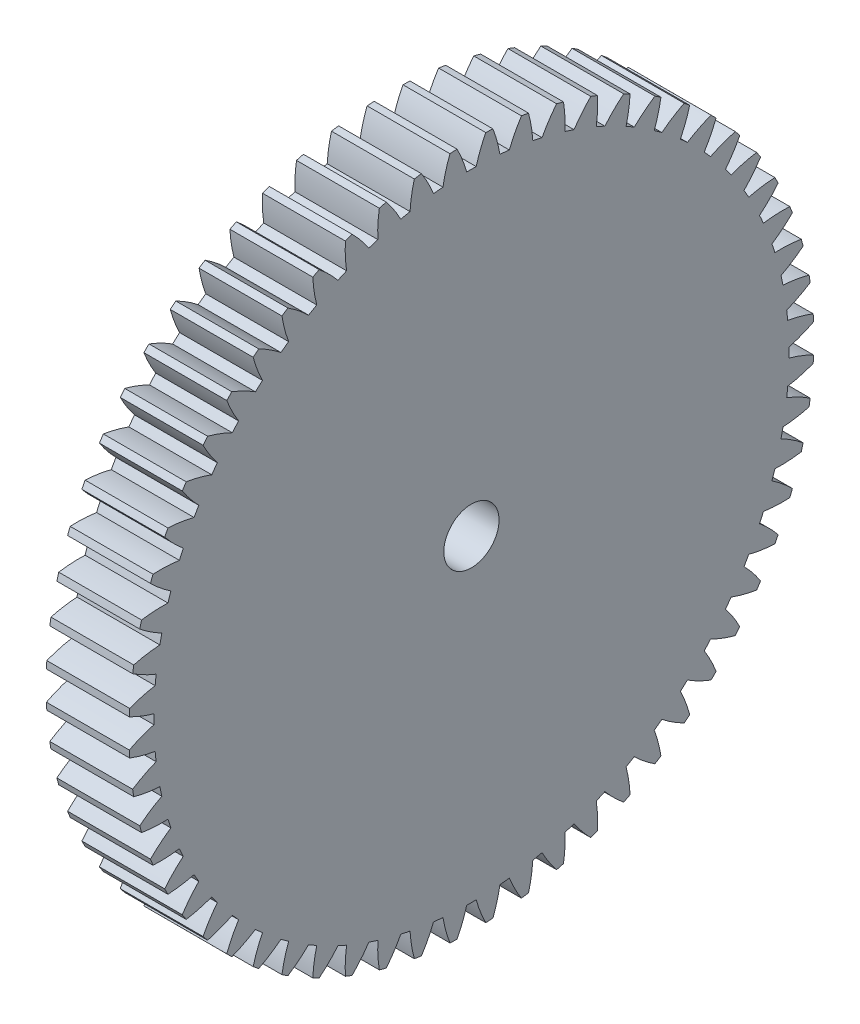
from build123d import *

# Parameters (mm, degrees)
BASPROSKE_W        = 3
BASPROSKE_H        = 12.4
TOOTHCUT_DEPTH     = 18.791008965
TEETHCUTS_COUNT    = 60
TEETHCUTS_ANGLE    = 354
BORSKE_R           = 1
BORE_DEPTH         = 50.0000508
SKETCH1_R          = 2.5
CUT_EXTRUDE1_DEPTH = 1.5


with BuildPart() as part:
    # BasProSke → Base-Revolve (revolve)
    with BuildSketch(Plane(origin=(0, 0, 0), x_dir=(1, 0, 0), z_dir=(0, 1, 0)), mode=Mode.PRIVATE) as base_revolve_sk:
        with Locations((1.5, 6.2)):
            Rectangle(BASPROSKE_W, BASPROSKE_H)
    revolve(base_revolve_sk.sketch.rotate(Axis((-10, 0, 0), (1, 0, 0)), 180), axis=Axis((-10, 0, 0), (1, 0, 0)))

    # TooCutSke → ToothCut (cut, through all)
    with BuildSketch(Plane(origin=(0, 0, 0), x_dir=(0, 0, -1), z_dir=(1, 0, 0))):
        with BuildLine():
            ThreePointArc((0.171558345, 11.497720154), (0, 11.499), (-0.171558345, 11.497720154))
            ThreePointArc((-0.171558345, 11.497720154), (-0.328424625, 11.965132696), (-0.532410419, 12.413988251))
            ThreePointArc((-0.532410419, 12.413988251), (0, 12.4254), (0.532410419, 12.413988251))
            ThreePointArc((0.532410419, 12.413988251), (0.328424625, 11.965132696), (0.171558345, 11.497720154))
        make_face()
    toothcut = extrude(amount=TOOTHCUT_DEPTH, mode=Mode.SUBTRACT)

    # TeethCuts: ToothCut ×60 about axis
    teethcuts_axis = Axis((-10, 0, 0), (1, 0, 0))
    for i in range(1, TEETHCUTS_COUNT):
        add(toothcut.rotate(teethcuts_axis, i * TEETHCUTS_ANGLE / (TEETHCUTS_COUNT - 1)), mode=Mode.SUBTRACT)

    # BorSke → Bore (cut, symmetric)
    with BuildSketch(Plane(origin=(0, 0, 0), x_dir=(0, 0, -1), z_dir=(1, 0, 0))):
        with Locations(Location((0, 0, 0), (0, 0, 180))):
            Circle(BORSKE_R)
    extrude(amount=BORE_DEPTH, both=True, mode=Mode.SUBTRACT)

    # Sketch1 → Cut-Extrude1 (cut)
    with BuildSketch(Plane.ZY):
        Circle(SKETCH1_R)
    extrude(amount=-CUT_EXTRUDE1_DEPTH, mode=Mode.SUBTRACT)


solid = part.part
